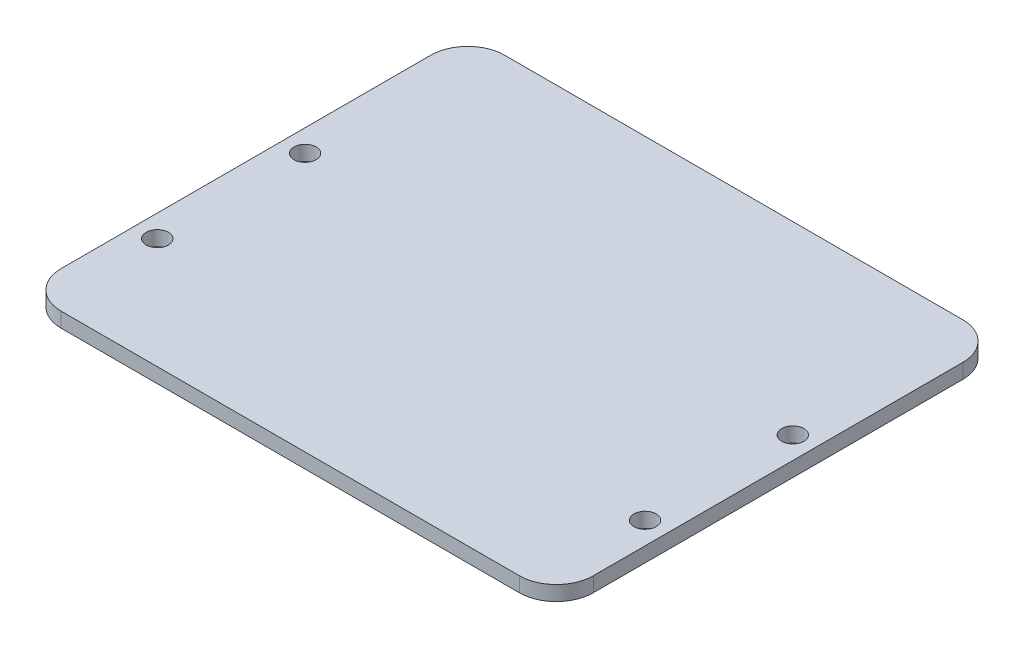
from build123d import *

# Parameters (mm, degrees)
SKETCH_1_W      = 72
SKETCH_1_H      = 60
SKETCH_1_R      = 1.5
EXTRUDE_1_DEPTH = 2
FILLET_1_R      = 5


with BuildPart() as part:
    # 草图1 → 凸台-拉伸1 (new body)
    with BuildSketch(Plane(origin=(0, 0, 0), x_dir=(1, 0, 0), z_dir=(0, 1, 0))):
        Rectangle(SKETCH_1_W, SKETCH_1_H)
        with Locations(Location((-33, 5, 0), (0, 0, 270))):
            Circle(SKETCH_1_R, mode=Mode.SUBTRACT)
        with Locations(Location((-33, -15, 0), (0, 0, 270))):
            Circle(SKETCH_1_R, mode=Mode.SUBTRACT)
        with Locations(Location((33, -15, 0), (0, 0, 90))):
            Circle(SKETCH_1_R, mode=Mode.SUBTRACT)
        with Locations(Location((33, 5, 0), (0, 0, 90))):
            Circle(SKETCH_1_R, mode=Mode.SUBTRACT)
    extrude(amount=EXTRUDE_1_DEPTH)

    # 圆角1
    fillet_1_edges = [part.edges().sort_by_distance(p)[0] for p in [
        (36, 1, 30),
        (-36, 1, 30),
        (-36, 1, -30),
        (36, 1, -30),
    ]]
    fillet(fillet_1_edges, radius=FILLET_1_R)


solid = part.part
